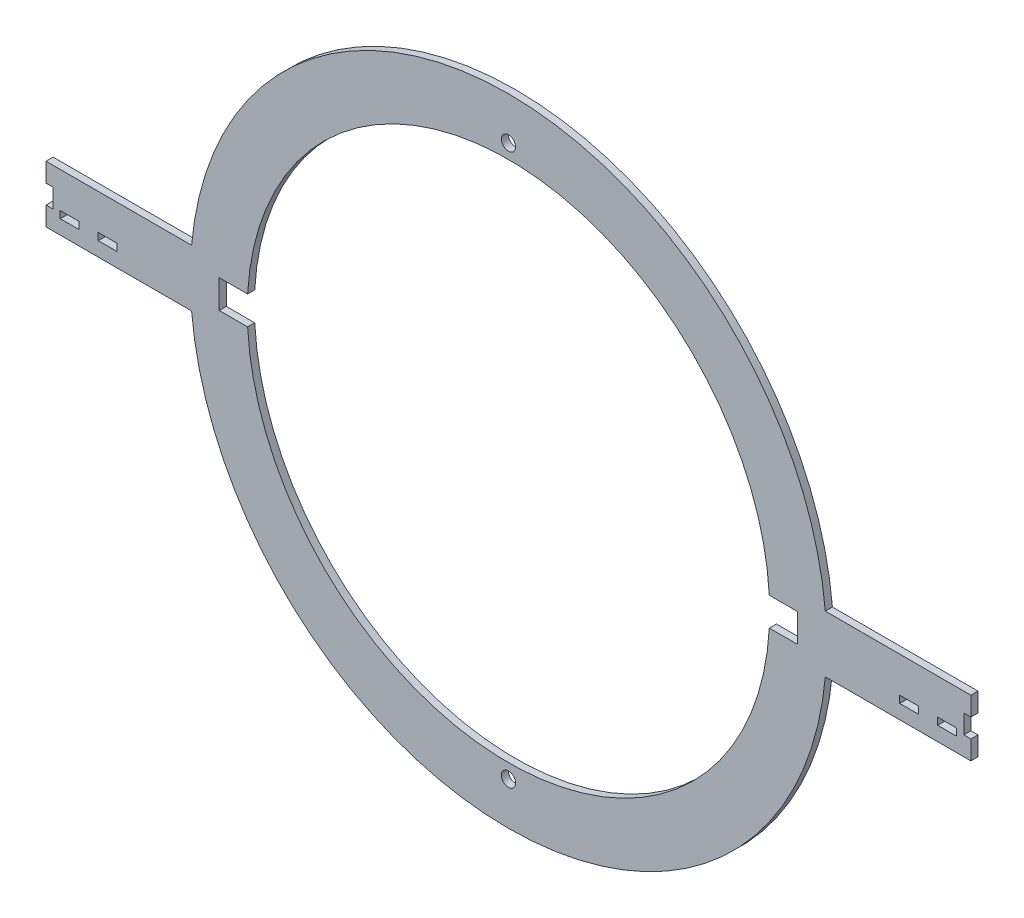
from build123d import *

# Parameters (mm, degrees)
SKETCH1_R           = 141.9733
SKETCH1_R_2         = 116.5733
BOSS_EXTRUDE1_DEPTH = 3.175
CUT_EXTRUDE1_START  = -3.175
SKETCH2_W           = 3.175
SKETCH2_H           = 8.466666666
CUT_EXTRUDE1_DEPTH  = 3.175
SKETCH3_R           = 3.175
CUT_EXTRUDE2_DEPTH  = 3.175
SKETCH4_W           = 8.466666667
SKETCH4_H           = 3.175
CUT_EXTRUDE3_DEPTH  = 3.175


with BuildPart() as part:
    # Sketch1 → Boss-Extrude1 (new body)
    # profile 1 of 3: a face of its own
    with BuildSketch(Plane.XY):
        with BuildLine():
            Line((-206.375, -12.7), (-141.404129759, -12.7))
            ThreePointArc((-141.404129759, -12.7), (-141.9733, 0), (-141.404129759, 12.7))
            Line((-141.404129759, 12.7), (-206.375, 12.7))
            Line((-206.375, 12.7), (-206.375, -12.7))
        make_face()
    # profile 2 of 3: a face of its own
    with BuildSketch(Plane.XY):
        Circle(SKETCH1_R)
        Circle(SKETCH1_R_2, mode=Mode.SUBTRACT)
    # profile 3 of 3: a face of its own
    with BuildSketch(Plane.XY):
        with BuildLine():
            ThreePointArc((141.9733, 0), (141.830936062, -6.356373863), (141.404129759, -12.7))
            Line((141.404129759, -12.7), (206.375, -12.7))
            Line((206.375, -12.7), (206.375, 12.7))
            Line((206.375, 12.7), (141.404129759, 12.7))
            ThreePointArc((141.404129759, 12.7), (141.830936062, 6.356373863), (141.9733, 0))
        make_face()
    extrude(amount=BOSS_EXTRUDE1_DEPTH)

    # Sketch2 → Cut-Extrude1 (cut)
    with BuildSketch(Plane.XY.offset(3.175).offset(CUT_EXTRUDE1_START)):
        with Locations((-204.7875, 0)):
            Rectangle(SKETCH2_W, SKETCH2_H)
        with BuildLine():
            Line((-116.400222392, 6.35), (-129.100222392, 6.35))
            Line((-129.100222392, 6.35), (-129.100222392, -6.35))
            Line((-129.100222392, -6.35), (-116.400222392, -6.35))
            ThreePointArc((-116.400222392, -6.35), (-116.5733, 0), (-116.400222392, 6.35))
        make_face()
    cut_extrude1 = extrude(amount=CUT_EXTRUDE1_DEPTH, mode=Mode.SUBTRACT)

    # Mirror1: Cut-Extrude1 across plane
    add(cut_extrude1.mirror(Plane(origin=(0, 0, 0), x_dir=(0, 0, 1), z_dir=(1, 0, 0))), mode=Mode.SUBTRACT)

    # Sketch3 → Cut-Extrude2 (cut)
    with BuildSketch(Plane.XY.offset(3.175)):
        with Locations((0, 122.936)):
            Circle(SKETCH3_R)
    cut_extrude2 = extrude(amount=-CUT_EXTRUDE2_DEPTH, mode=Mode.SUBTRACT)

    # Mirror2: Cut-Extrude2 across plane
    add(cut_extrude2.mirror(Plane.ZX), mode=Mode.SUBTRACT)

    # Sketch4 → Cut-Extrude3 (cut)
    with BuildSketch(Plane.XY.offset(3.175)):
        with Locations((195.791666667, -4.7625)):
            Rectangle(SKETCH4_W, SKETCH4_H)
        with Locations((178.858333334, -4.7625)):
            Rectangle(SKETCH4_W, SKETCH4_H)
    cut_extrude3 = extrude(amount=-CUT_EXTRUDE3_DEPTH, mode=Mode.SUBTRACT)

    # Mirror3: Cut-Extrude3 across plane
    add(cut_extrude3.mirror(Plane(origin=(0, 0, 0), x_dir=(0, 0, 1), z_dir=(1, 0, 0))), mode=Mode.SUBTRACT)


solid = part.part
